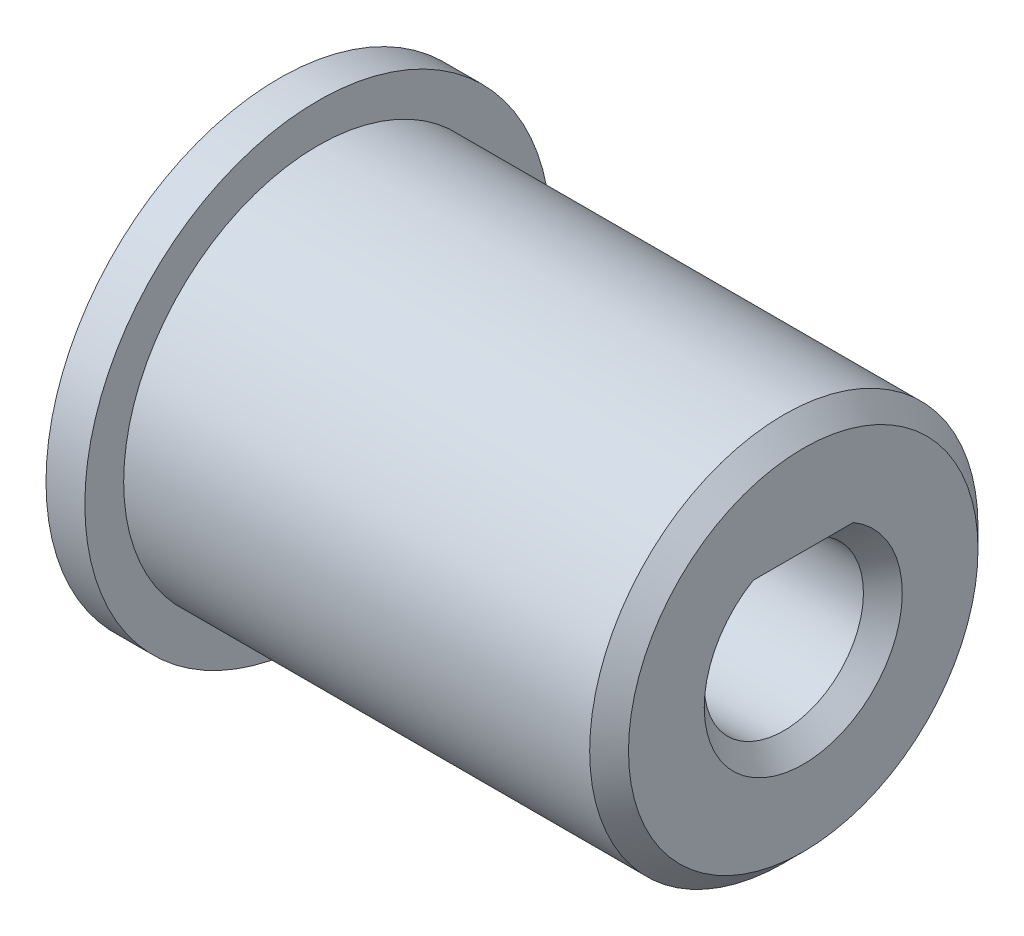
from build123d import *

# Parameters (mm, degrees)
SKIZZE2_R                            = 10
AUFSATZ_LINEAR_AUSTRAGEN1_DEPTH      = 25
SKIZZE3_R                            = 12
AUFSATZ_LINEAR_AUSTRAGEN2_DEPTH      = 2
SCHNITT_LINEAR_AUSTRAGEN1_DEPTH      = 15
FASE1_SIZE                           = 1
FASE2_SIZE                           = 1
F_3_1_3_1_DURCHMESSER_BOHRUNG1_D     = 3.1
F_3_1_3_1_DURCHMESSER_BOHRUNG1_DEPTH = 7
F_3_1_3_1_DURCHMESSER_BOHRUNG1_TIP   = 0.931333959
FASE3_SIZE                           = 1


with BuildPart() as part:
    # Skizze2 → Aufsatz-Linear austragen1 (new body)
    with BuildSketch(Plane(origin=(0, 0, 0), x_dir=(0, 0, -1), z_dir=(1, 0, 0))):
        Circle(SKIZZE2_R)
    extrude(amount=AUFSATZ_LINEAR_AUSTRAGEN1_DEPTH)

    # Skizze3 → Aufsatz-Linear austragen2 (add)
    with BuildSketch(Plane.ZY):
        Circle(SKIZZE3_R)
    extrude(amount=AUFSATZ_LINEAR_AUSTRAGEN2_DEPTH)

    # Skizze4 → Schnitt-Linear austragen1 (cut)
    with BuildSketch(Plane(origin=(25, 0, 0), x_dir=(0, 0, -1), z_dir=(1, 0, 0))):
        with BuildLine():
            Line((-2.291287847, 3.4), (2.291287847, 3.4))
            ThreePointArc((2.291287847, 3.4), (0, -4.1), (-2.291287847, 3.4))
        make_face()
    extrude(amount=-SCHNITT_LINEAR_AUSTRAGEN1_DEPTH, mode=Mode.SUBTRACT)

    # Fase1
    fase1_edges = [part.edges().sort_by_distance(p)[0] for p in [
        (25, -4.1, 0),
        (25, 3.4, 0),
    ]]
    chamfer(fase1_edges, length=FASE1_SIZE)

    # Fase2
    fase2_edges = [part.edges().sort_by_distance(p)[0] for p in [
        (25, 0, 10),
    ]]
    chamfer(fase2_edges, length=FASE2_SIZE)

    # Ø3.1 (3.1) Durchmesser Bohrung1
    with Locations(Plane.ZY.offset(2)):
        with Locations((4.25, 0), (-4.25, 0)):
            Hole(F_3_1_3_1_DURCHMESSER_BOHRUNG1_D / 2, depth=F_3_1_3_1_DURCHMESSER_BOHRUNG1_DEPTH)
            with Locations((0, 0, -(F_3_1_3_1_DURCHMESSER_BOHRUNG1_DEPTH + F_3_1_3_1_DURCHMESSER_BOHRUNG1_TIP / 2))):  # 118° drill point
                Cone(0, F_3_1_3_1_DURCHMESSER_BOHRUNG1_D / 2, F_3_1_3_1_DURCHMESSER_BOHRUNG1_TIP, mode=Mode.SUBTRACT)

    # Fase3
    fase3_edges = [part.edges().sort_by_distance(p)[0] for p in [
        (-2, 0, 5.8),
        (-2, 0, -2.7),
    ]]
    chamfer(fase3_edges, length=FASE3_SIZE)


solid = part.part
